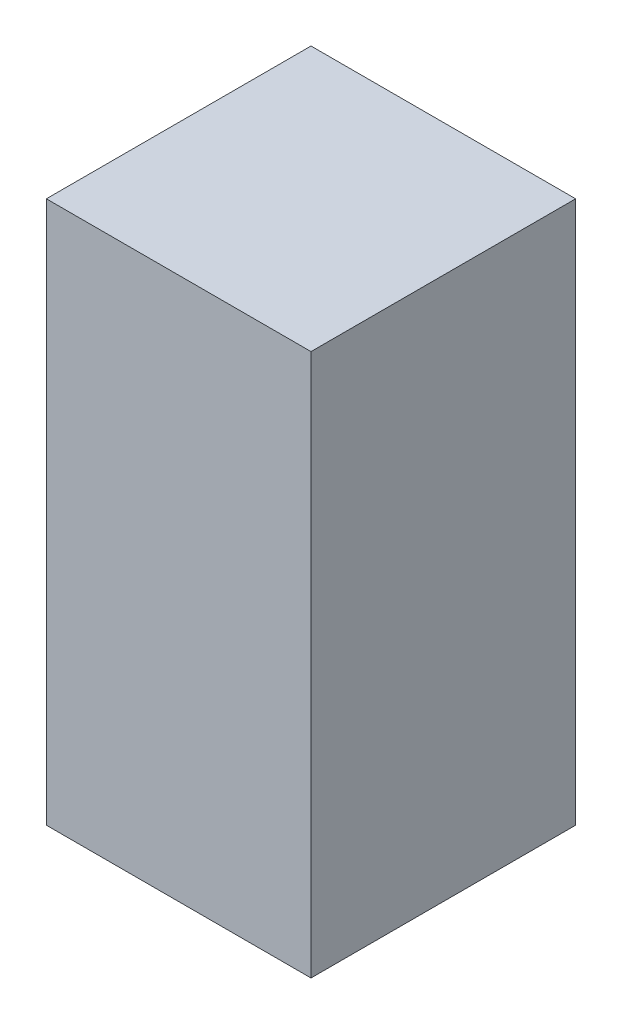
from build123d import *

# Parameters (mm, degrees)
SKETCH1_W           = 2
SKETCH1_H           = 4.1
BOSS_EXTRUDE1_DEPTH = 2


with BuildPart() as part:
    # Sketch1 → Boss-Extrude1 (new body)
    with BuildSketch(Plane(origin=(0, 0, 0), x_dir=(0, 0, -1), z_dir=(1, 0, 0))):
        Rectangle(SKETCH1_W, SKETCH1_H)
    extrude(amount=BOSS_EXTRUDE1_DEPTH)


solid = part.part
